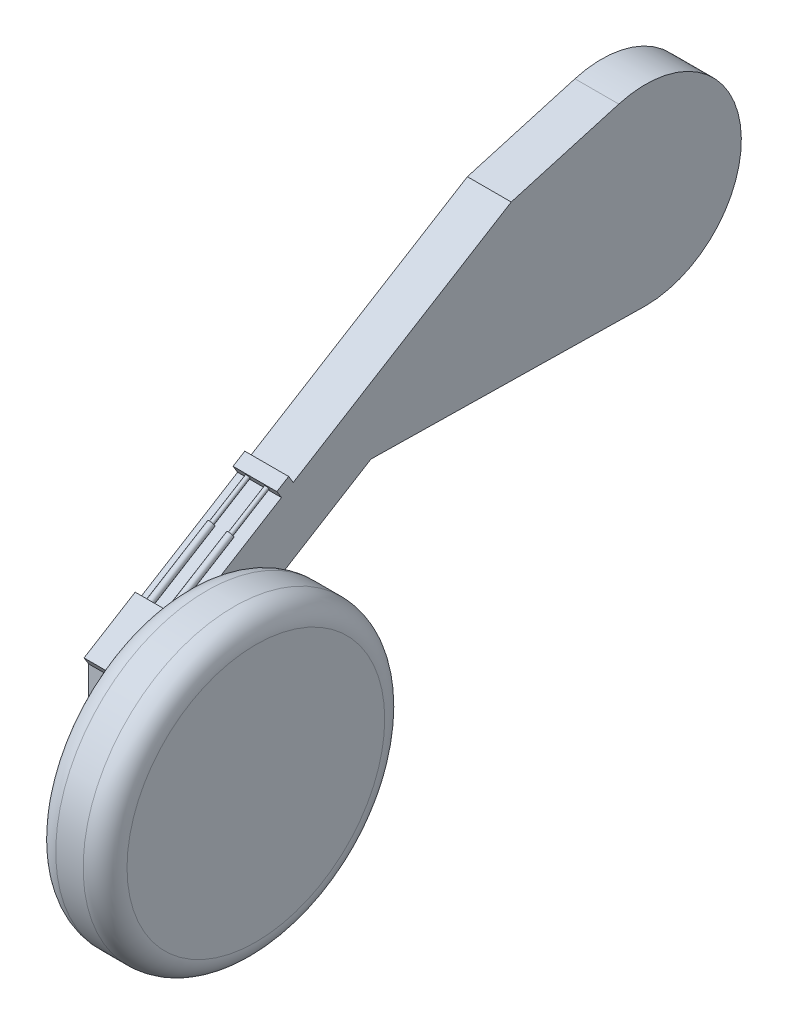
from build123d import *

# Parameters (mm, degrees)
BOSS_EXTRUDE1_DEPTH = 80
SKETCH3_R           = 50
CUT_EXTRUDE1_DEPTH  = 60
SKETCH4_W           = 80
SKETCH4_H           = 25.189285717
BOSS_EXTRUDE2_DEPTH = 16
SKETCH5_W           = 80
SKETCH5_H           = 109.43946138
BOSS_EXTRUDE3_DEPTH = 16
SKETCH6_R           = 3.834610425
BOSS_EXTRUDE4_DEPTH = 78
SKETCH7_R           = 6
BOSS_EXTRUDE5_DEPTH = 135
SKETCH9_R           = 20
BOSS_EXTRUDE6_DEPTH = 50
SKETCH10_R          = 275
BOSS_EXTRUDE7_DEPTH = 130
FILLET1_R           = 40


with BuildPart() as part:
    # Sketch1 → Boss-Extrude1 (new body)
    with BuildSketch(Plane(origin=(0, 0, 0), x_dir=(0, 0, -1), z_dir=(1, 0, 0))):
        with BuildLine():
            Line((-48.50457236, 168.143707763), (-244.683369844, 111.551826897))
            Line((-244.683369844, 111.551826897), (-935.480433622, -312.64385861))
            Line((-935.480433622, -312.64385861), (-935.480433622, -439.618269219))
            Line((-935.480433622, -439.618269219), (-846.646989911, -439.618269219))
            Line((-846.646989911, -439.618269219), (-846.646989911, -379.079220955))
            Line((-846.646989911, -379.079220955), (-500.622904168, -166.597246219))
            Line((-500.622904168, -166.597246219), (0, -175))
            ThreePointArc((0, -175), (173.277449281, 24.4933781), (-48.50457236, 168.143707763))
        make_face()
    extrude(amount=BOSS_EXTRUDE1_DEPTH)

    # Sketch3 → Cut-Extrude1 (cut)
    with BuildSketch(Plane.ZY):
        Circle(SKETCH3_R)
    extrude(amount=-CUT_EXTRUDE1_DEPTH, mode=Mode.SUBTRACT)

    # Sketch4 → Boss-Extrude2 (add)
    with BuildSketch(Plane(origin=(0, 190.115415773, 116.743604378), x_dir=(1, 0, 0), z_dir=(0, 0.8521590965506677, 0.5232827860401581))):
        with Locations((40, -629.342954153)):
            Rectangle(SKETCH4_W, SKETCH4_H)
    extrude(amount=BOSS_EXTRUDE2_DEPTH)

    # Sketch5 → Boss-Extrude3 (add)
    with BuildSketch(Plane(origin=(0, 190.115415773, 116.743604378), x_dir=(1, 0, 0), z_dir=(0, 0.8521590965506677, 0.5232827860401581))):
        with Locations((40, -906.059579837)):
            Rectangle(SKETCH5_W, SKETCH5_H)
    extrude(amount=BOSS_EXTRUDE3_DEPTH)

    # Sketch6 → Boss-Extrude4 (add)
    with BuildSketch(Plane(origin=(0, -335.914894228, 547.032962711), x_dir=(1, 0, 0), z_dir=(0, -0.5232827860401581, 0.8521590965506677))):
        with Locations(Location((22.669741736, 230.944821583, 0), (0, 0, 90))):
            Circle(SKETCH6_R)
        with Locations(Location((57.330258264, 230.944821583, 0), (0, 0, 90))):
            Circle(SKETCH6_R)
    extrude(amount=BOSS_EXTRUDE4_DEPTH)

    # Sketch7 → Boss-Extrude5 (add)
    with BuildSketch(Plane(origin=(0, -376.730951539, 613.501372242), x_dir=(1, 0, 0), z_dir=(0, -0.5232827860401581, 0.8521590965506677))):
        with Locations(Location((22.669741736, 230.944821583, 0), (0, 0, 270))):
            Circle(SKETCH7_R)
        with Locations(Location((57.330258264, 230.944821583, 0), (0, 0, 270))):
            Circle(SKETCH7_R)
    extrude(amount=BOSS_EXTRUDE5_DEPTH)

    # Sketch9 → Boss-Extrude6 (add)
    with BuildSketch(Plane(origin=(80, 0, 0), x_dir=(0, 0, -1), z_dir=(1, 0, 0))):
        with Locations((-890.480433622, -409.618269219)):
            Circle(SKETCH9_R)
    extrude(amount=BOSS_EXTRUDE6_DEPTH)

    # Sketch10 → Boss-Extrude7 (add)
    with BuildSketch(Plane(origin=(130, 0, 0), x_dir=(0, 0, -1), z_dir=(1, 0, 0))):
        with Locations((-890.480433622, -409.618269219)):
            Circle(SKETCH10_R)
    extrude(amount=BOSS_EXTRUDE7_DEPTH)

    # Fillet1
    fillet1_edges = [part.edges().sort_by_distance(p)[0] for p in [
        (130, -409.618269219, 1165.480433622),
        (260, -409.618269219, 1165.480433622),
    ]]
    fillet(fillet1_edges, radius=FILLET1_R)


solid = part.part
